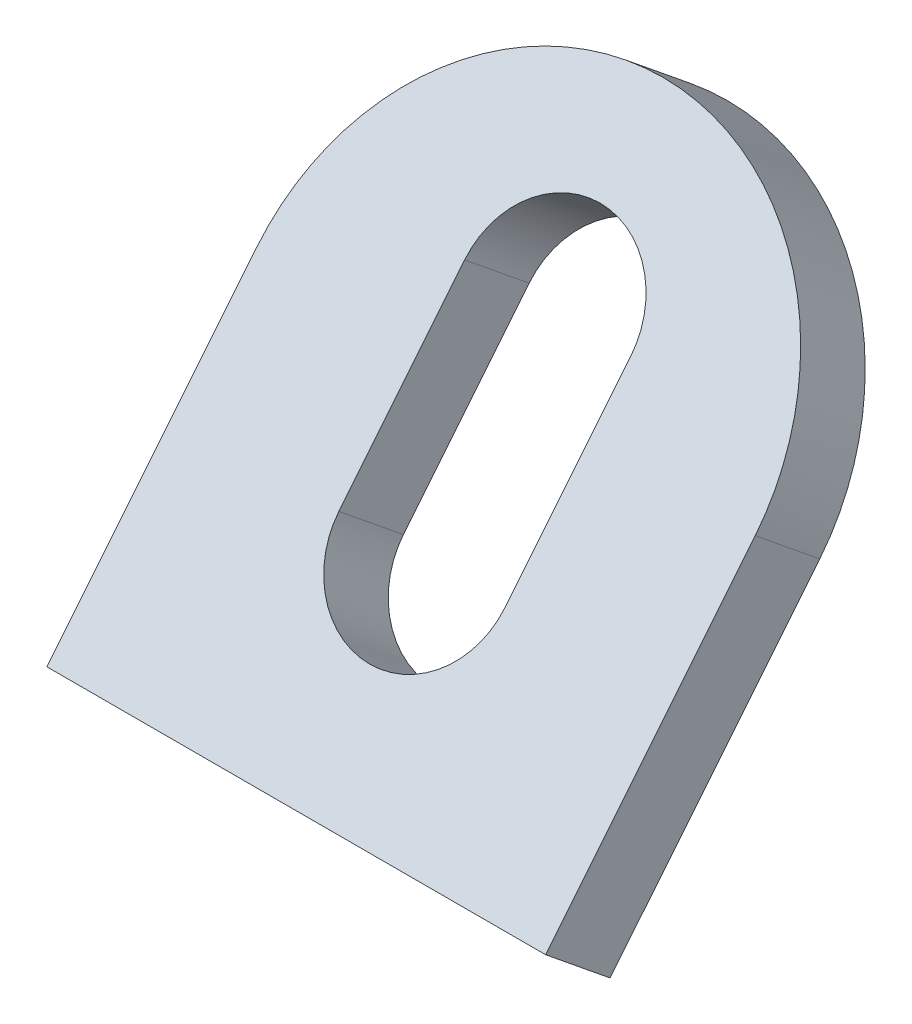
from build123d import *

# Parameters (mm, degrees)
BOSS_EXTRUDE1_DEPTH = 3.175


with BuildPart() as part:
    # Sketch1 → Boss-Extrude1 (new body)
    with BuildSketch(Plane(origin=(0, 861.782639484, -474.087130342), x_dir=(1, 0, 0), z_dir=(0, -0.6305119962615922, -0.7761795040905306))):
        with BuildLine():
            Line((-223.72134979, 531.878808959), (-204.67134979, 531.878808959))
            Line((-204.67134979, 531.878808959), (-204.67134979, 519.178808959))
            ThreePointArc((-204.67134979, 519.178808959), (-214.19634979, 509.653808959), (-223.72134979, 519.178808959))
            Line((-223.72134979, 519.178808959), (-223.72134979, 531.878808959))
        make_face()
        with BuildLine():
            Line((-211.02134979, 516.638808959), (-211.02134979, 524.258808959))
            ThreePointArc((-211.02134979, 524.258808959), (-214.19634979, 527.433808959), (-217.37134979, 524.258808959))
            Line((-217.37134979, 524.258808959), (-217.37134979, 516.638808959))
            ThreePointArc((-217.37134979, 516.638808959), (-214.19634979, 513.463808959), (-211.02134979, 516.638808959))
        make_face(mode=Mode.SUBTRACT)
    extrude(amount=BOSS_EXTRUDE1_DEPTH)


solid = part.part
